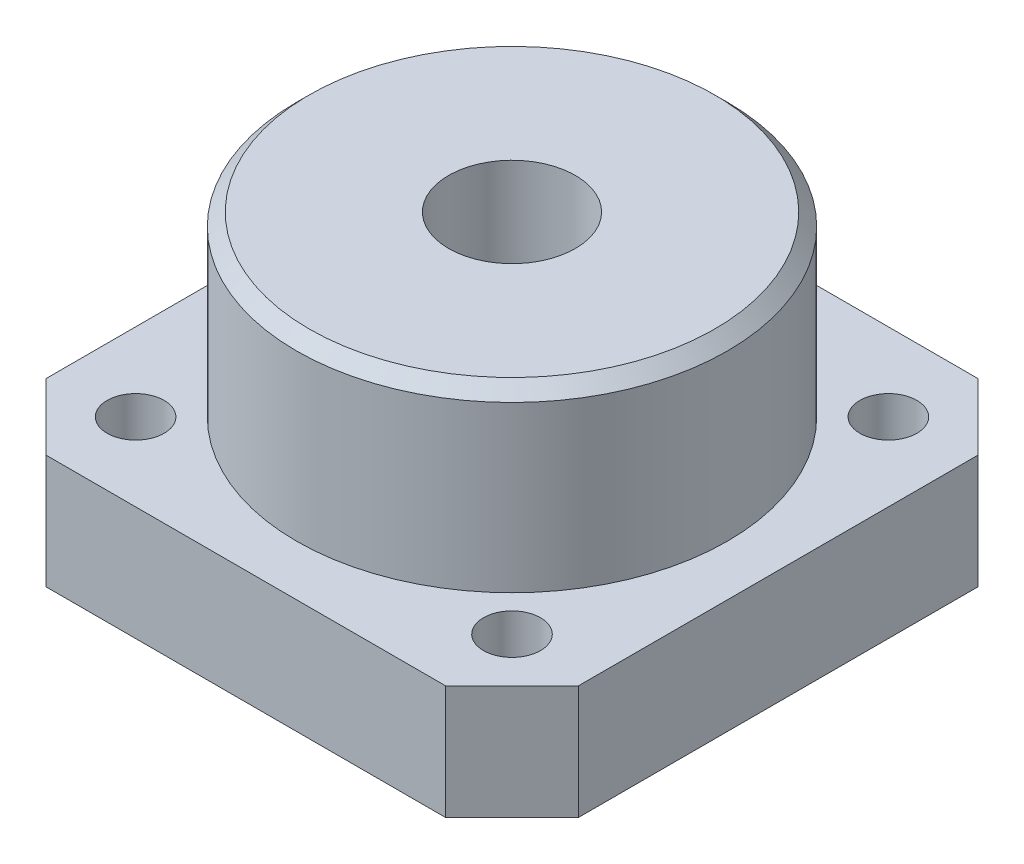
from build123d import *

# Parameters (mm, degrees)
SKETCH_1_R          = 2.25
EXTRUDE_1_DEPTH     = 9
SKETCH_2_R          = 4
CUT_EXTRUDE_1_DEPTH = 4
SKETCH_3_R          = 17
EXTRUDE_2_DEPTH     = 14
SKETCH_4_R          = 13
SKETCH_4_R_2        = 11
EXTRUDE_3_DEPTH     = 7.5
CUT_EXTRUDE_2_REACH = 44.571
SKETCH_5_R          = 5
CHAMFER_1_SIZE      = 1


with BuildPart() as part:
    # 草图1 → 凸台-拉伸1 (new body)
    with BuildSketch(Plane(origin=(0, 0, 0), x_dir=(1, 0, 0), z_dir=(0, 1, 0))):
        Polygon((0, 21), (15.769552622, 21), (21, 15.769552622), (21, 0), (21, -15.769552622), (15.769552622, -21), (0, -21), (-15.769552622, -21), (-21, -15.769552622), (-21, 0), (-21, 15.769552622), (-15.769552622, 21), align=None)
        with Locations(Location((14.849242405, 14.849242405, 0), (0, 0, 270))):
            Circle(SKETCH_1_R, mode=Mode.SUBTRACT)
        with Locations(Location((14.849242405, -14.849242405, 0), (0, 0, 270))):
            Circle(SKETCH_1_R, mode=Mode.SUBTRACT)
        with Locations(Location((-14.849242405, -14.849242405, 0), (0, 0, 270))):
            Circle(SKETCH_1_R, mode=Mode.SUBTRACT)
        with Locations(Location((-14.849242405, 14.849242405, 0), (0, 0, 270))):
            Circle(SKETCH_1_R, mode=Mode.SUBTRACT)
    extrude(amount=EXTRUDE_1_DEPTH)

    # 草图2 → 切除-拉伸1 (cut)
    with BuildSketch(Plane(origin=(0, 0, 0), x_dir=(1, 0, 0), z_dir=(0, 1, 0))):
        with Locations(Location((-14.849242405, 14.849242405, 0), (0, 0, 270))):
            Circle(SKETCH_2_R)
        with Locations(Location((14.849242405, 14.849242405, 0), (0, 0, 270))):
            Circle(SKETCH_2_R)
        with Locations(Location((14.849242405, -14.849242405, 0), (0, 0, 270))):
            Circle(SKETCH_2_R)
        with Locations(Location((-14.849242405, -14.849242405, 0), (0, 0, 270))):
            Circle(SKETCH_2_R)
    extrude(amount=CUT_EXTRUDE_1_DEPTH, mode=Mode.SUBTRACT)

    # 草图3 → 凸台-拉伸2 (add)
    with BuildSketch(Plane(origin=(0, 9, 0), x_dir=(1, 0, 0), z_dir=(0, 1, 0))):
        with Locations(Location((0, 0, 0), (0, 0, 270))):
            Circle(SKETCH_3_R)
    extrude(amount=EXTRUDE_2_DEPTH)

    # 草图4 → 凸台-拉伸3 (add)
    with BuildSketch(Plane.XZ):
        with Locations(Location((0, 0, 0), (0, 0, 270))):
            Circle(SKETCH_4_R)
        with Locations(Location((0, 0, 0), (0, 0, 270))):
            Circle(SKETCH_4_R_2, mode=Mode.SUBTRACT)
    extrude(amount=EXTRUDE_3_DEPTH)

    # 草图5 → 切除-拉伸2 (cut, up to next)
    with BuildSketch(Plane(origin=(0, 23, 0), x_dir=(1, 0, 0), z_dir=(0, 1, 0)), mode=Mode.PRIVATE) as cut_extrude_2_sk1:
        with Locations(Location((0, 0, 0), (0, 0, 270))):
            Circle(SKETCH_5_R)
    cut_extrude_2_tool1 = extrude(cut_extrude_2_sk1.sketch, amount=-CUT_EXTRUDE_2_REACH, mode=Mode.PRIVATE) & part.part
    add(cut_extrude_2_tool1.solids().sort_by_distance((0, 23, 0))[0], mode=Mode.SUBTRACT)

    # 倒角1
    chamfer_1_edges = [part.edges().sort_by_distance(p)[0] for p in [
        (0, 23, -17),
        (0, -7.5, 13),
    ]]
    chamfer(chamfer_1_edges, length=CHAMFER_1_SIZE)


solid = part.part
